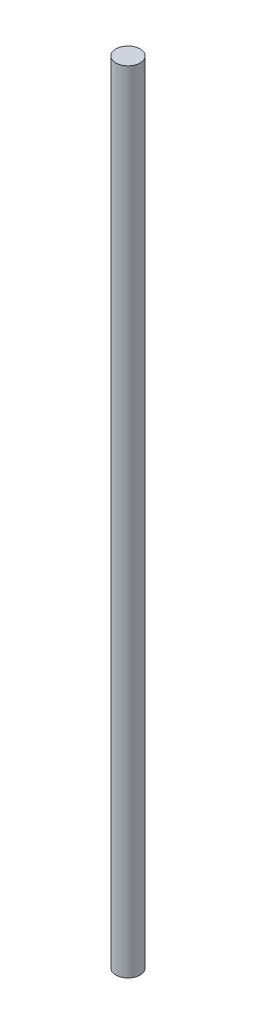
from build123d import *

# Parameters (mm, degrees)
SKETCH1_R           = 2
BOSS_EXTRUDE1_DEPTH = 130


with BuildPart() as part:
    # Sketch1 → Boss-Extrude1 (new body)
    with BuildSketch(Plane(origin=(0, 0, 0), x_dir=(1, 0, 0), z_dir=(0, 1, 0))):
        with Locations(Location((0, 0, 0), (0, 0, 270))):
            Circle(SKETCH1_R)
    extrude(amount=BOSS_EXTRUDE1_DEPTH)


solid = part.part
